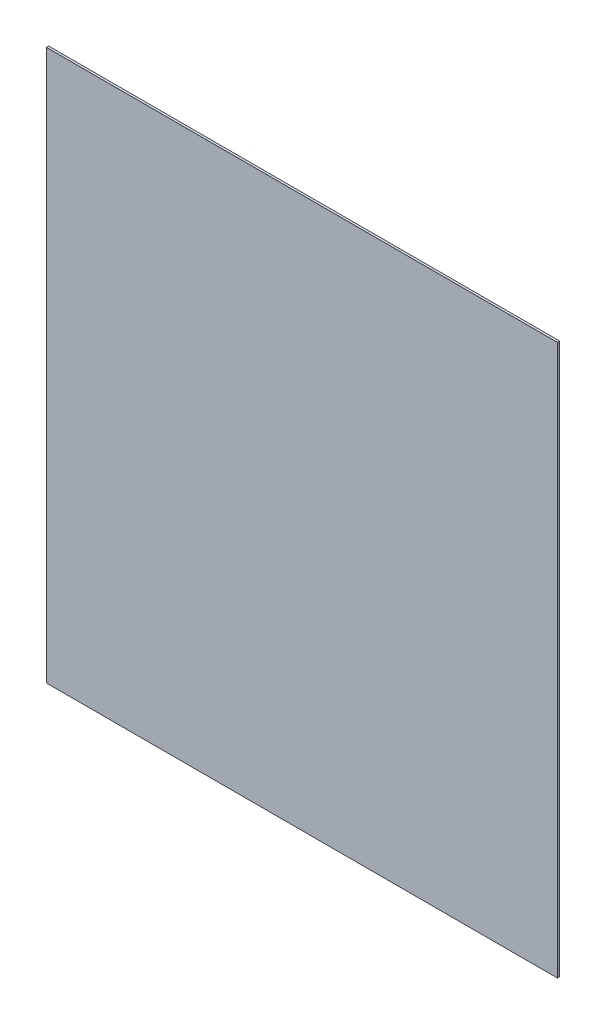
from build123d import *

# Parameters (mm, degrees)
SKETCH1_W           = 558.8
SKETCH1_H           = 601.98
BOSS_EXTRUDE1_DEPTH = 2.54


with BuildPart() as part:
    # Sketch1 → Boss-Extrude1 (new body)
    with BuildSketch(Plane.XY):
        Rectangle(SKETCH1_W, SKETCH1_H)
    extrude(amount=BOSS_EXTRUDE1_DEPTH)


solid = part.part
